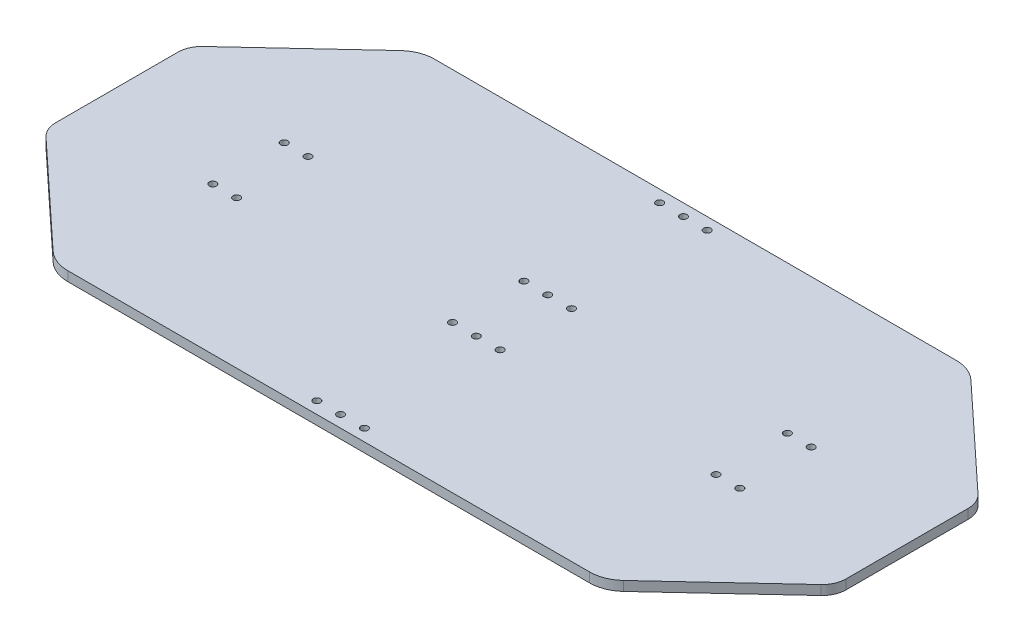
from build123d import *

# Parameters (mm, degrees)
EXTRUDE_1_DEPTH     = 4
SKETCH_3_R          = 1.5
CUT_EXTRUDE_1_DEPTH = 184.032783949


with BuildPart() as part:
    # 草图1 → 凸台-拉伸1 (new body)
    with BuildSketch(Plane(origin=(0, 0, 0), x_dir=(1, 0, 0), z_dir=(0, 1, 0))):
        with BuildLine():
            Line((-119.819061856, 72.980279065), (-162.812846416, 32.966261751))
            ThreePointArc((-162.812846416, 32.966261751), (-165.168654868, 29.638038623), (-166, 25.646075708))
            Line((-166, 25.646075708), (-166, -25.646075708))
            ThreePointArc((-166, -25.646075708), (-165.168654868, -29.638038623), (-162.812846416, -32.966261751))
            Line((-162.812846416, -32.966261751), (-119.819061856, -72.980279065))
            ThreePointArc((-119.819061856, -72.980279065), (-115.090503207, -75.958943119), (-109.599792231, -77))
            Line((-109.599792231, -77), (109.599792231, -77))
            ThreePointArc((109.599792231, -77), (115.090503207, -75.958943119), (119.819061856, -72.980279065))
            Line((119.819061856, -72.980279065), (162.812846416, -32.966261751))
            ThreePointArc((162.812846416, -32.966261751), (165.168654868, -29.638038623), (166, -25.646075708))
            Line((166, -25.646075708), (166, 25.646075708))
            ThreePointArc((166, 25.646075708), (165.168654868, 29.638038623), (162.812846416, 32.966261751))
            Line((162.812846416, 32.966261751), (119.819061856, 72.980279065))
            ThreePointArc((119.819061856, 72.980279065), (115.090503207, 75.958943119), (109.599792231, 77))
            Line((109.599792231, 77), (-109.599792231, 77))
            ThreePointArc((-109.599792231, 77), (-115.090503207, 75.958943119), (-119.819061856, 72.980279065))
        make_face()
    extrude(amount=EXTRUDE_1_DEPTH)

    # 草图3 → 切除-拉伸1 (cut, through all)
    with BuildSketch(Plane(origin=(0, 4, 0), x_dir=(1, 0, 0), z_dir=(0, 1, 0))):
        with Locations(Location((10, -72, 0), (0, 0, 270))):
            Circle(SKETCH_3_R)
        with Locations(Location((0, -72, 0), (0, 0, 270))):
            Circle(SKETCH_3_R)
        with Locations(Location((-10, -72, 0), (0, 0, 270))):
            Circle(SKETCH_3_R)
        with Locations(Location((10, -15, 0), (0, 0, 270))):
            Circle(SKETCH_3_R)
        with Locations(Location((0, -15, 0), (0, 0, 270))):
            Circle(SKETCH_3_R)
        with Locations(Location((-10, -15, 0), (0, 0, 270))):
            Circle(SKETCH_3_R)
        with Locations(Location((10, 15, 0), (0, 0, 270))):
            Circle(SKETCH_3_R)
        with Locations(Location((0, 15, 0), (0, 0, 270))):
            Circle(SKETCH_3_R)
        with Locations(Location((-10, 15, 0), (0, 0, 270))):
            Circle(SKETCH_3_R)
        with Locations(Location((10, 72, 0), (0, 0, 270))):
            Circle(SKETCH_3_R)
        with Locations(Location((0, 72, 0), (0, 0, 270))):
            Circle(SKETCH_3_R)
        with Locations(Location((-10, 72, 0), (0, 0, 270))):
            Circle(SKETCH_3_R)
        with Locations(Location((-100.7, 15, 0), (0, 0, 270))):
            Circle(SKETCH_3_R)
        with Locations(Location((-110.7, 15, 0), (0, 0, 270))):
            Circle(SKETCH_3_R)
        with Locations(Location((-100.7, -15, 0), (0, 0, 270))):
            Circle(SKETCH_3_R)
        with Locations(Location((-110.7, -15, 0), (0, 0, 270))):
            Circle(SKETCH_3_R)
        with Locations(Location((100.7, 15, 0), (0, 0, 270))):
            Circle(SKETCH_3_R)
        with Locations(Location((110.7, 15, 0), (0, 0, 270))):
            Circle(SKETCH_3_R)
        with Locations(Location((100.7, -15, 0), (0, 0, 270))):
            Circle(SKETCH_3_R)
        with Locations(Location((110.7, -15, 0), (0, 0, 270))):
            Circle(SKETCH_3_R)
    extrude(amount=-CUT_EXTRUDE_1_DEPTH, mode=Mode.SUBTRACT)


solid = part.part
